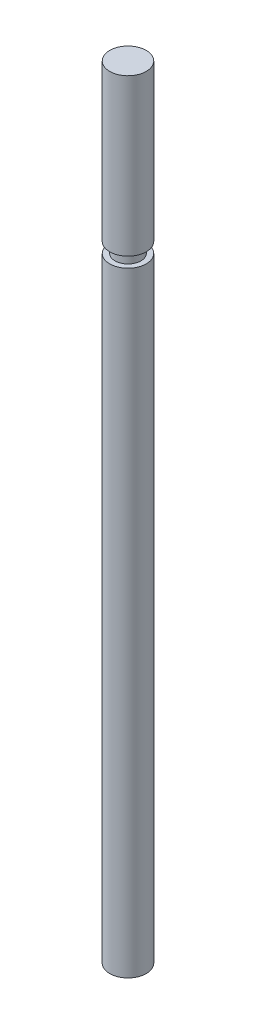
from build123d import *

# Parameters (mm, degrees)
SKETCH1_R           = 1.75
BOSS_EXTRUDE1_DEPTH = 75
CUT_EXTRUDE1_START  = -1
SKETCH2_R           = 1.75
SKETCH2_R_2         = 1.25
CUT_EXTRUDE1_DEPTH  = 1


with BuildPart() as part:
    # Sketch1 → Boss-Extrude1 (new body)
    with BuildSketch(Plane(origin=(0, 0, 0), x_dir=(1, 0, 0), z_dir=(0, 1, 0))):
        with Locations(Location((0, 0, 0), (0, 0, 270))):
            Circle(SKETCH1_R)
    extrude(amount=BOSS_EXTRUDE1_DEPTH)

    # Sketch2 → Cut-Extrude1 (cut)
    with BuildSketch(Plane(origin=(0, 60, 0), x_dir=(1, 0, 0), z_dir=(0, 1, 0)).offset(CUT_EXTRUDE1_START)):
        with Locations(Location((0, 0, 0), (0, 0, 270))):
            Circle(SKETCH2_R)
        with Locations(Location((0, 0, 0), (0, 0, 270))):
            Circle(SKETCH2_R_2, mode=Mode.SUBTRACT)
    extrude(amount=CUT_EXTRUDE1_DEPTH, mode=Mode.SUBTRACT)


solid = part.part
